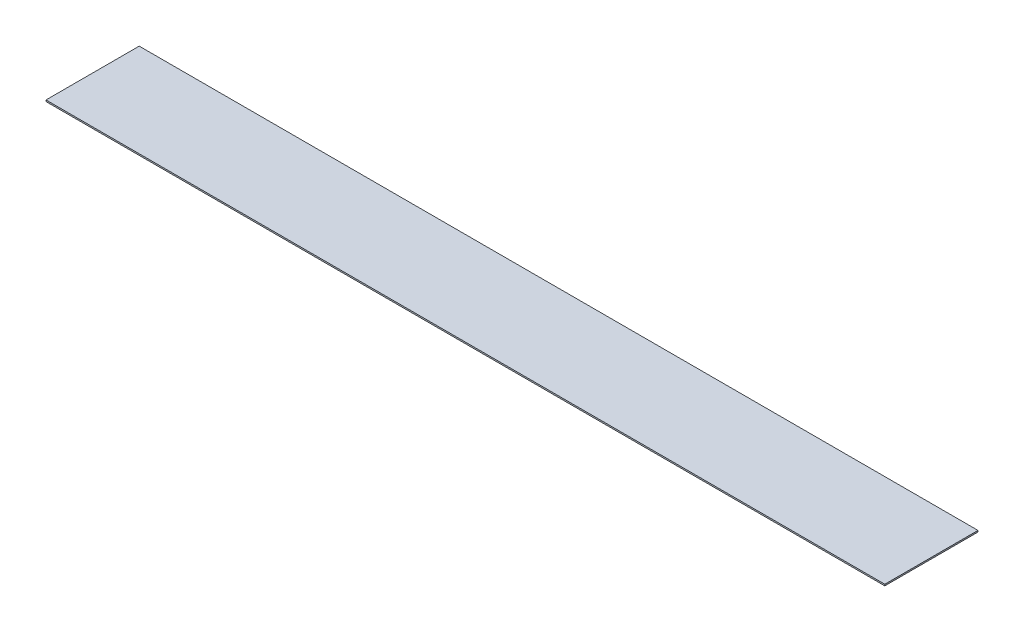
from build123d import *

# Parameters (mm, degrees)
SKETCH1_W           = 914.4
SKETCH1_H           = 101.6
BOSS_EXTRUDE1_DEPTH = 1.5875


with BuildPart() as part:
    # Sketch1 → Boss-Extrude1 (new body)
    with BuildSketch(Plane(origin=(0, 0, 0), x_dir=(1, 0, 0), z_dir=(0, 1, 0))):
        with Locations((457.2, 50.8)):
            Rectangle(SKETCH1_W, SKETCH1_H)
    extrude(amount=BOSS_EXTRUDE1_DEPTH)


solid = part.part
